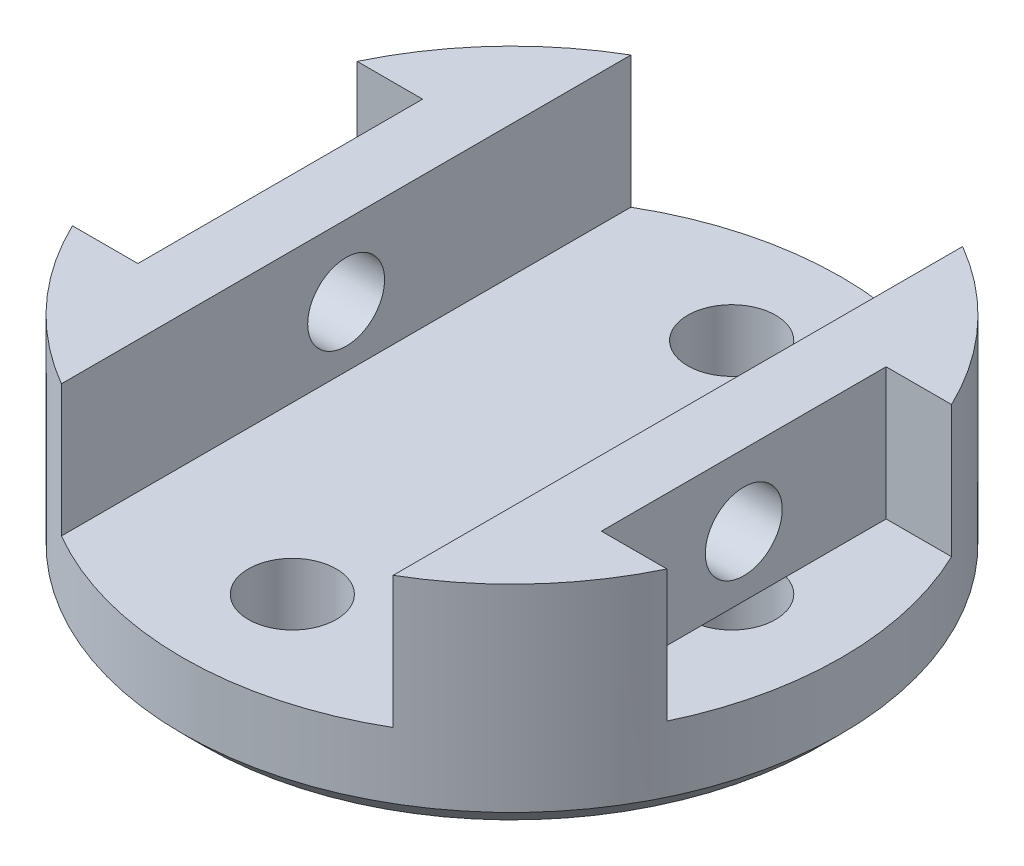
from build123d import *
from build123d.topology import SkipClean

# Parameters (mm, degrees)
SKETCH1_R           = 15
BOSS_EXTRUDE1_DEPTH = 4
SKETCH2_R           = 2
CUT_EXTRUDE1_DEPTH  = 5
BOSS_EXTRUDE3_DEPTH = 10
CHAMFER1_SIZE       = 1
SKETCH5_R           = 1.75
CUT_EXTRUDE2_DEPTH  = 37.345563691
CUT_EXTRUDE4_DEPTH  = 4.45
SKETCH8_W           = 12.961384956
SKETCH8_H           = 10
CUT_EXTRUDE5_DEPTH  = 4.45
SKETCH9_R           = 16.342219082
CUT_EXTRUDE6_DEPTH  = 4


with BuildPart() as part:
    # Sketch1 → Boss-Extrude1 (new body)
    with BuildSketch(Plane(origin=(0, 0, 0), x_dir=(1, 0, 0), z_dir=(0, 1, 0))):
        with Locations(Location((0, 0, 0), (0, 0, 270))):
            Circle(SKETCH1_R)
    extrude(amount=BOSS_EXTRUDE1_DEPTH)

    # Sketch2 → Cut-Extrude1 (cut)
    with BuildSketch(Plane(origin=(0, 4, 0), x_dir=(1, 0, 0), z_dir=(0, 1, 0))):
        with Locations(Location((-10, 0, 0), (0, 0, 270))):
            Circle(SKETCH2_R)
        with Locations(Location((0, 10, 0), (0, 0, 270))):
            Circle(SKETCH2_R)
        with Locations(Location((10, 0, 0), (0, 0, 270))):
            Circle(SKETCH2_R)
        with Locations(Location((0, -10, 0), (0, 0, 270))):
            Circle(SKETCH2_R)
    extrude(amount=-CUT_EXTRUDE1_DEPTH, mode=Mode.SUBTRACT)

    # Sketch4 → Boss-Extrude3 (add)
    with SkipClean():  # the faces are left unmerged after this step: merging them gives an invalid solid
        with BuildSketch(Plane(origin=(0, 4, 0), x_dir=(1, 0, 0), z_dir=(0, 1, 0))):
            with BuildLine():
                Line((-7.55, -12.961384957), (-7.55, -0.968245837))
                Line((-7.55, -0.968245837), (-7.55, 0.968245837))
                Line((-7.55, 0.968245837), (-7.55, 12.961384957))
                ThreePointArc((-7.55, 12.961384957), (-15, 0), (-7.55, -12.961384957))
            make_face()
            with BuildLine():
                Line((7.55, -12.961384957), (7.55, -0.968245837))
                Line((7.55, -0.968245837), (7.55, 0.968245837))
                Line((7.55, 0.968245837), (7.55, 12.961384957))
                ThreePointArc((7.55, 12.961384957), (15, 0), (7.55, -12.961384957))
            make_face()
        extrude(amount=BOSS_EXTRUDE3_DEPTH)

    # Chamfer1
    chamfer1_edges = [part.edges().sort_by_distance(p)[0] for p in [
        (0, 0, -15),
    ]]
    chamfer(chamfer1_edges, length=CHAMFER1_SIZE)

    # Sketch5 → Cut-Extrude2 (cut, through all)
    with SkipClean():  # the faces are left unmerged after this step: merging them gives an invalid solid
        with BuildSketch(Plane(origin=(15, 0, 0), x_dir=(0, 0, -1), z_dir=(1, 0, 0))):
            with Locations((0, 6.75)):
                Circle(SKETCH5_R)
        extrude(amount=-CUT_EXTRUDE2_DEPTH, mode=Mode.SUBTRACT)

    # Sketch7 → Cut-Extrude4 (cut)
    with BuildSketch(Plane(origin=(15, 0, 0), x_dir=(0, 0, -1), z_dir=(1, 0, 0))):
        Polygon((-6.480692478, 9), (-6.480692478, 4), (0, 4), (0, 14), (-6.480692478, 14), align=None)
        Polygon((0, 14), (0, 4), (6.480692478, 4), (6.480692478, 9), (6.480692478, 14), align=None)
    extrude(amount=-CUT_EXTRUDE4_DEPTH, mode=Mode.SUBTRACT)

    # Sketch8 → Cut-Extrude5 (cut)
    with BuildSketch(Plane.ZY.offset(15)):
        with Locations((0, 9)):
            Rectangle(SKETCH8_W, SKETCH8_H)
    extrude(amount=-CUT_EXTRUDE5_DEPTH, mode=Mode.SUBTRACT)

    # Sketch9 → Cut-Extrude6 (cut)
    with SkipClean():  # the faces are left unmerged after this step: merging them gives an invalid solid
        with BuildSketch(Plane(origin=(0, 14, 0), x_dir=(1, 0, 0), z_dir=(0, 1, 0))):
            Circle(SKETCH9_R)
        extrude(amount=-CUT_EXTRUDE6_DEPTH, mode=Mode.SUBTRACT)


solid = part.part
